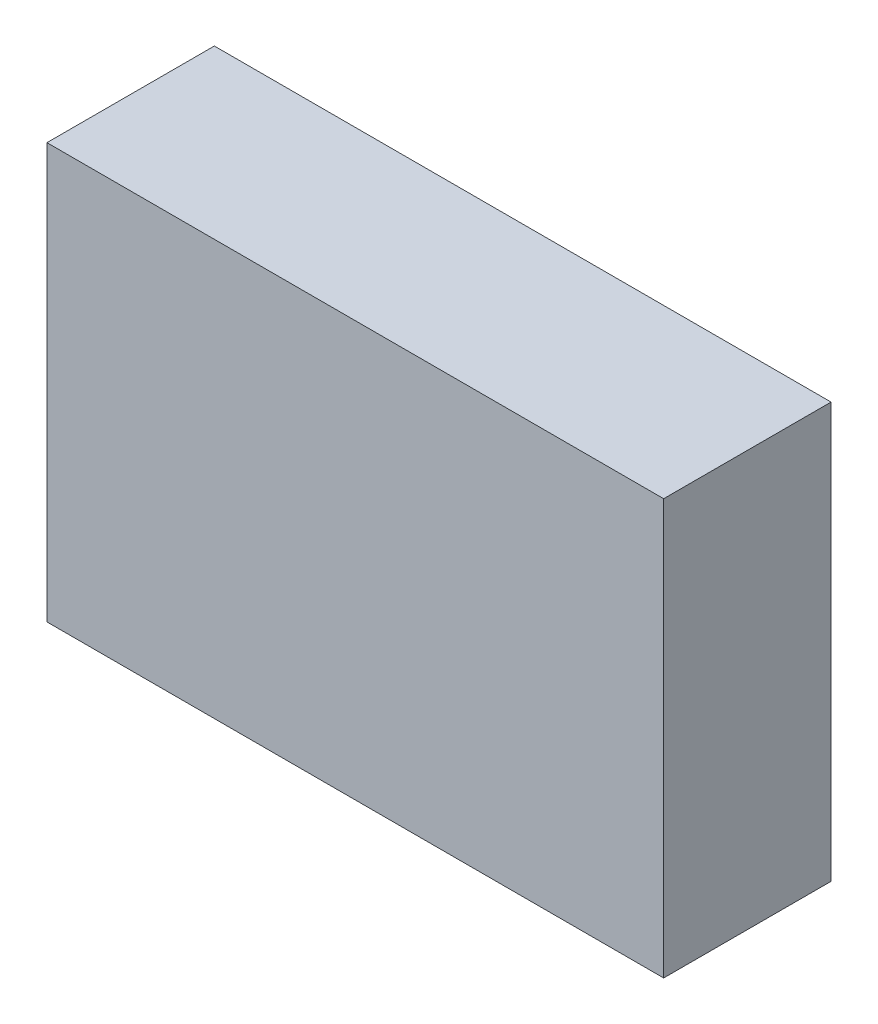
from build123d import *

# Parameters (mm, degrees)
SKETCH_1_W      = 67.2
SKETCH_1_H      = 45.23
EXTRUDE_1_DEPTH = 18.24


with BuildPart() as part:
    # 草图1 → 凸台-拉伸1 (new body)
    with BuildSketch(Plane.XY):
        with Locations((33.6, -22.615)):
            Rectangle(SKETCH_1_W, SKETCH_1_H)
    extrude(amount=EXTRUDE_1_DEPTH)


solid = part.part
